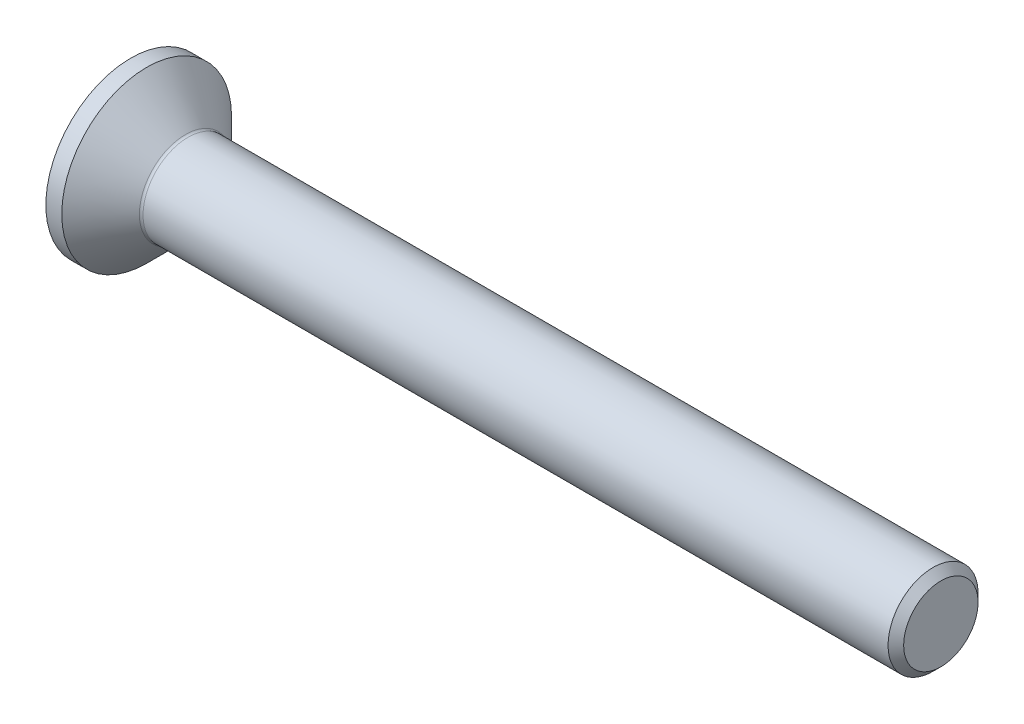
from build123d import *

# Parameters (mm, degrees)
HEXAGONSOCKET_DEPTH = 1.9
HEADFILLET_R        = 0.2
CHAMFER_2_SIZE      = 0.433
SKETCH4_W           = 5
SKETCH4_H           = 5


with BuildPart() as part:
    # Sketch1 → Base (revolve)
    with BuildSketch(Plane.XY, mode=Mode.PRIVATE) as base_sk:
        Polygon((0, 0), (0, 5.6), (3.1, 2.5), (45, 2.5), (45, 0), align=None)
    revolve(base_sk.sketch.rotate(Axis((-0.587069181, 0, 0), (1, 0, 0)), 90), axis=Axis((-0.587069181, 0, 0), (1, 0, 0)))

    # Sketch2 → HexagonSocket (cut)
    with BuildSketch(Plane(origin=(0, 0, 0), x_dir=(0, 0, -1), z_dir=(1, 0, 0))):
        Polygon((1.732050808, 0), (0.866025404, 1.5), (-0.866025404, 1.5), (-1.732050808, 0), (-0.866025404, -1.5), (0.866025404, -1.5), align=None)
    extrude(amount=HEXAGONSOCKET_DEPTH, mode=Mode.SUBTRACT)

    # Sketch3 → Cut-Revolve1 (revolve, cut)
    with BuildSketch(Plane.XY, mode=Mode.PRIVATE) as cut_revolve1_sk:
        Polygon((1.9, 1.5), (2.766025404, 0), (1.9, 0), align=None)
    revolve(cut_revolve1_sk.sketch.rotate(Axis((-0.439109555, 0, 0), (1, 0, 0)), 90), axis=Axis((-0.439109555, 0, 0), (1, 0, 0)), mode=Mode.SUBTRACT)

    # HeadFillet
    headfillet_edges = [part.edges().sort_by_distance(p)[0] for p in [
        (3.1, 0, -2.5),
    ]]
    fillet(headfillet_edges, radius=HEADFILLET_R)

    # Chamfer 2
    chamfer_2_edges = [part.edges().sort_by_distance(p)[0] for p in [
        (45, 0, -2.5),
    ]]
    chamfer(chamfer_2_edges, length=CHAMFER_2_SIZE)

    # Sketch4 → Cut-Revolve2 (revolve, cut)
    with BuildSketch(Plane(origin=(0, 0, 0), x_dir=(1, 0, 0), z_dir=(0, 1, 0)), mode=Mode.PRIVATE) as cut_revolve2_sk:
        with Locations((0.5, 7.215)):
            Rectangle(SKETCH4_W, SKETCH4_H)
    revolve(cut_revolve2_sk.sketch.rotate(Axis((11.853138686, 0, 0), (-1, 0, 0)), 180), axis=Axis((11.853138686, 0, 0), (-1, 0, 0)), mode=Mode.SUBTRACT)


solid = part.part
